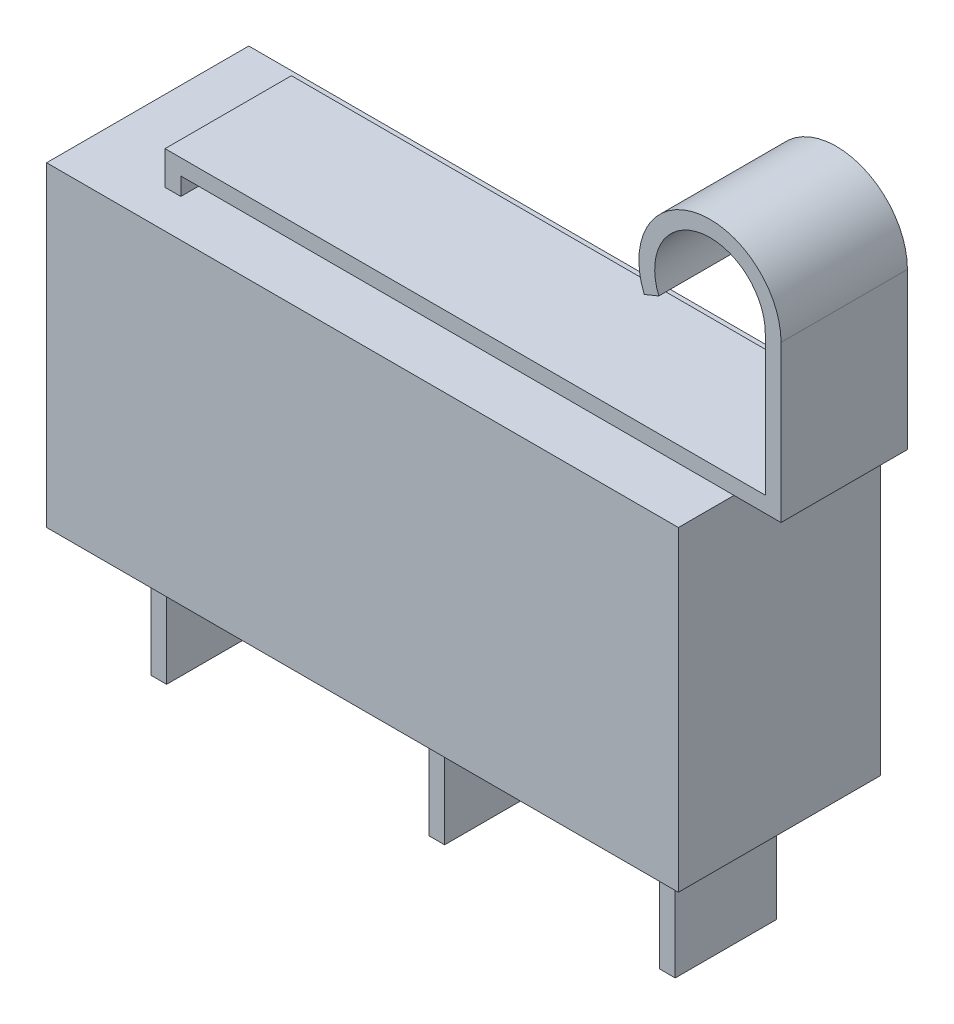
from build123d import *

# Parameters (mm, degrees)
SKETCH_1_W        = 20
SKETCH_1_H        = 10
EXTRUDE_1_DEPTH   = 3.2
SKETCH_2_W        = 0.5
SKETCH_2_H        = 3.2
EXTRUDE_1_2_DEPTH = 4
EXTRUDE_2_DEPTH   = 2


with BuildPart() as part:
    # Эскиз1 → Extrude 1 (new, symmetric)
    with BuildSketch(Plane.XY):
        with Locations((-10, 5)):
            Rectangle(SKETCH_1_W, SKETCH_1_H)
    extrude(amount=EXTRUDE_1_DEPTH, both=True)

    # Эскиз2 → Extrude 1 2 (add)
    with BuildSketch(Plane.XZ):
        with Locations((-18.05, 0)):
            Rectangle(SKETCH_2_W, SKETCH_2_H)
        with Locations((-9.25, 0)):
            Rectangle(SKETCH_2_W, SKETCH_2_H)
        with Locations((-1.95, 0)):
            Rectangle(SKETCH_2_W, SKETCH_2_H)
    extrude(amount=EXTRUDE_1_2_DEPTH)

    # Эскиз3 → Вытянуть-Тонкостенный2 (add, symmetric)
    with BuildSketch(Plane.XY):
        with BuildLine():
            Line((-16.95, 10), (-16.95, 10.561276731))
            Line((-16.95, 10.561276731), (2.05, 10.561276731))
            Line((2.05, 10.561276731), (2.05, 15.5))
            ThreePointArc((2.05, 15.5), (-0.634058048, 17.70773495), (-2.282527654, 14.648191002))
            Line((-2.282527654, 14.648191002), (-1.819743731, 14.83748189))
            ThreePointArc((-1.819743731, 14.83748189), (-0.537600704, 17.217127184), (1.55, 15.5))
            Line((1.55, 15.5), (1.55, 11.061276731))
            Line((1.55, 11.061276731), (-17.45, 11.061276731))
            Line((-17.45, 11.061276731), (-17.45, 10))
            Line((-17.45, 10), (-16.95, 10))
        make_face()
    extrude(amount=EXTRUDE_2_DEPTH, both=True)


solid = part.part
